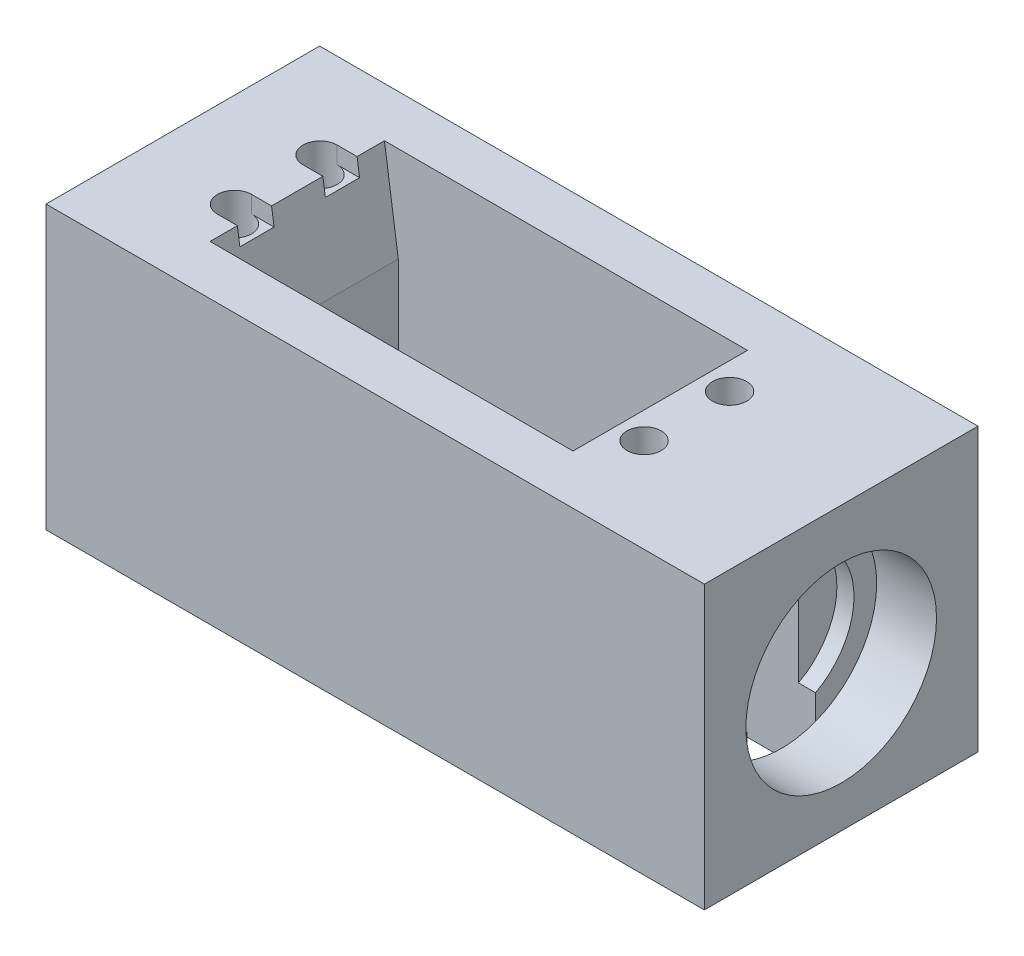
from build123d import *

# Parameters (mm, degrees)
BOSS_EXTRUDE1_DEPTH  = 5
SKETCH6_R            = 2
CUT_EXTRUDE3_DEPTH   = 53.239831546
SKETCH7_W            = 56
SKETCH7_H            = 6
BOSS_EXTRUDE2_DEPTH  = 28
SKETCH9_W            = 20
SKETCH9_H            = 28
BOSS_EXTRUDE3_DEPTH  = 2
SKETCH8_W            = 26
SKETCH8_H            = 33
BOSS_EXTRUDE4_DEPTH  = 2
BOSS_EXTRUDE5_START  = 28
SKETCH10_W           = 8
SKETCH10_H           = 20
SKETCH10_R           = 2
BOSS_EXTRUDE5_DEPTH  = 28
CUT_EXTRUDE4_DEPTH   = 20
SKETCH13_W           = 3.95
SKETCH13_H           = 4
CUT_EXTRUDE5_DEPTH   = 2
SKETCH14_W           = 60
SKETCH14_H           = 33
BOSS_EXTRUDE6_DEPTH  = 6
SKETCH15_R           = 2
BOSS_EXTRUDE7_DEPTH  = 20
SKETCH16_W           = 32
SKETCH16_H           = 33
BOSS_EXTRUDE8_DEPTH  = 12
SKETCH20_W           = 32
SKETCH20_H           = 33
BOSS_EXTRUDE9_DEPTH  = 5
SKETCH17_R           = 11.15
CUT_EXTRUDE6_DEPTH   = 7
CUT_EXTRUDE7_START   = -7
SKETCH19_R           = 11.15
CUT_EXTRUDE7_DEPTH   = 7
SKETCH21_R           = 8.5
CUT_EXTRUDE8_DEPTH   = 2
CUT_EXTRUDE10_START  = -28
SKETCH22_W           = 7
SKETCH22_H           = 8
CUT_EXTRUDE10_DEPTH  = 28
SKETCH25_W           = 8
SKETCH25_H           = 6
BOSS_EXTRUDE10_DEPTH = 28
CUT_EXTRUDE11_START  = -12
SKETCH26_R           = 2
CUT_EXTRUDE11_DEPTH  = 12
CUT_EXTRUDE12_START  = -2
SKETCH27_R           = 8.5
CUT_EXTRUDE12_DEPTH  = 2
CUT_EXTRUDE13_DEPTH  = 0.2
CUT_EXTRUDE14_DEPTH  = 0.2


with BuildPart() as part:
    # Sketch2 → Boss-Extrude1 (new body)
    with BuildSketch(Plane(origin=(0, 0, 0), x_dir=(1, 0, 0), z_dir=(0, 1, 0))):
        Polygon((0, 0), (0, 20), (-8, 20), (-8, -6), (48, -6), (48, 20), (40, 20), (40, 0), align=None)
    extrude(amount=BOSS_EXTRUDE1_DEPTH)

    # Sketch6 → Cut-Extrude3 (cut, through all)
    with BuildSketch(Plane.XZ):
        with Locations(Location((43.95, -5, 0), (0, 0, 270))):
            Circle(SKETCH6_R)
        with Locations(Location((43.95, -15, 0), (0, 0, 270))):
            Circle(SKETCH6_R)
        with Locations(Location((-3.95, -5, 0), (0, 0, 270))):
            Circle(SKETCH6_R)
        with Locations(Location((-3.95, -15, 0), (0, 0, 270))):
            Circle(SKETCH6_R)
    extrude(amount=-CUT_EXTRUDE3_DEPTH, mode=Mode.SUBTRACT)

    # Sketch7 → Boss-Extrude2 (add)
    with BuildSketch(Plane.XZ):
        with Locations((20, 3)):
            Rectangle(SKETCH7_W, SKETCH7_H)
    extrude(amount=BOSS_EXTRUDE2_DEPTH)

    # Sketch9 → Boss-Extrude3 (add)
    with BuildSketch(Plane.ZY.offset(8)):
        Polygon((-20, 5), (-20, 0), (0, 0), (0, -28), (6, -28), (6, 5), align=None)
        with Locations((-10, -14)):
            Rectangle(SKETCH9_W, SKETCH9_H)
    extrude(amount=BOSS_EXTRUDE3_DEPTH)

    # Sketch8 → Boss-Extrude4 (add)
    with BuildSketch(Plane(origin=(48, 0, 0), x_dir=(0, 0, -1), z_dir=(1, 0, 0))):
        with Locations((7, -11.5)):
            Rectangle(SKETCH8_W, SKETCH8_H)
    extrude(amount=BOSS_EXTRUDE4_DEPTH)

    # Sketch10 → Boss-Extrude5 (add)
    with BuildSketch(Plane.XZ.offset(BOSS_EXTRUDE5_START)):
        with Locations((-4, -10)):
            Rectangle(SKETCH10_W, SKETCH10_H)
        with Locations(Location((-3.95, -5, 0), (0, 0, 270))):
            Circle(SKETCH10_R, mode=Mode.SUBTRACT)
        with Locations(Location((-3.95, -15, 0), (0, 0, 270))):
            Circle(SKETCH10_R, mode=Mode.SUBTRACT)
    extrude(amount=-BOSS_EXTRUDE5_DEPTH)

    # Sketch12 → Cut-Extrude4 (cut)
    with BuildSketch(Plane(origin=(0, 0, -20), x_dir=(-1, 0, 0), z_dir=(0, 0, -1))):
        Polygon((-40, 5), (-40, 2.5), (-40.83785019, 5), align=None)
        Polygon((0, -6.167201623), (1.617522403, 5), (0, 5), align=None)
    extrude(amount=-CUT_EXTRUDE4_DEPTH, mode=Mode.SUBTRACT)

    # Sketch13 → Cut-Extrude5 (cut)
    with BuildSketch(Plane(origin=(0, 5, 0), x_dir=(1, 0, 0), z_dir=(0, 1, 0))):
        with Locations((-1.975, 5)):
            Rectangle(SKETCH13_W, SKETCH13_H)
        with Locations((-1.975, 15)):
            Rectangle(SKETCH13_W, SKETCH13_H)
    extrude(amount=-CUT_EXTRUDE5_DEPTH, mode=Mode.SUBTRACT)

    # Sketch14 → Boss-Extrude6 (add)
    with BuildSketch(Plane(origin=(0, 0, -20), x_dir=(-1, 0, 0), z_dir=(0, 0, -1))):
        with Locations((-20, -11.5)):
            Rectangle(SKETCH14_W, SKETCH14_H)
    extrude(amount=BOSS_EXTRUDE6_DEPTH)

    # Sketch15 → Boss-Extrude7 (add)
    with BuildSketch(Plane.XZ.offset(28)):
        with Locations(Location((-3.95, -5, 0), (0, 0, 270))):
            Circle(SKETCH15_R)
        with Locations(Location((-3.95, -15, 0), (0, 0, 270))):
            Circle(SKETCH15_R)
    extrude(amount=-BOSS_EXTRUDE7_DEPTH)

    # Sketch16 → Boss-Extrude8 (add)
    with BuildSketch(Plane(origin=(50, 0, 0), x_dir=(0, 0, -1), z_dir=(1, 0, 0))):
        with Locations((10, -11.5)):
            Rectangle(SKETCH16_W, SKETCH16_H)
    extrude(amount=BOSS_EXTRUDE8_DEPTH)

    # Sketch20 → Boss-Extrude9 (add)
    with BuildSketch(Plane.ZY.offset(10)):
        with Locations((-10, -11.5)):
            Rectangle(SKETCH20_W, SKETCH20_H)
    extrude(amount=BOSS_EXTRUDE9_DEPTH)

    # Sketch17 → Cut-Extrude6 (cut)
    with BuildSketch(Plane(origin=(62, 0, 0), x_dir=(0, 0, -1), z_dir=(1, 0, 0))):
        with Locations((10, -12)):
            Circle(SKETCH17_R)
    extrude(amount=-CUT_EXTRUDE6_DEPTH, mode=Mode.SUBTRACT)

    # Sketch19 → Cut-Extrude7 (cut)
    with BuildSketch(Plane.ZY.offset(15).offset(CUT_EXTRUDE7_START)):
        with Locations(Location((-10, -12, 0), (0, 0, 180))):
            Circle(SKETCH19_R)
    extrude(amount=CUT_EXTRUDE7_DEPTH, mode=Mode.SUBTRACT)

    # Sketch21 → Cut-Extrude8 (cut)
    with BuildSketch(Plane(origin=(55, 0, 0), x_dir=(0, 0, -1), z_dir=(1, 0, 0))):
        with Locations((10, -12)):
            Circle(SKETCH21_R)
    extrude(amount=-CUT_EXTRUDE8_DEPTH, mode=Mode.SUBTRACT)

    # Sketch22 → Cut-Extrude10 (cut)
    with BuildSketch(Plane.XZ.offset(28).offset(CUT_EXTRUDE10_START)):
        with Locations((51.5, -10)):
            Rectangle(SKETCH22_W, SKETCH22_H)
    extrude(amount=CUT_EXTRUDE10_DEPTH, mode=Mode.SUBTRACT)

    # Sketch25 → Boss-Extrude10 (add)
    with BuildSketch(Plane.XZ):
        with Locations((44, -3)):
            Rectangle(SKETCH25_W, SKETCH25_H)
        with Locations((44, -17)):
            Rectangle(SKETCH25_W, SKETCH25_H)
    extrude(amount=BOSS_EXTRUDE10_DEPTH)

    # Sketch26 → Cut-Extrude11 (cut)
    with BuildSketch(Plane(origin=(0, 5, 0), x_dir=(1, 0, 0), z_dir=(0, 1, 0)).offset(CUT_EXTRUDE11_START)):
        with Locations(Location((43.95, 5, 0), (0, 0, 90))):
            Circle(SKETCH26_R)
        with Locations(Location((43.95, 15, 0), (0, 0, 90))):
            Circle(SKETCH26_R)
    extrude(amount=CUT_EXTRUDE11_DEPTH, mode=Mode.SUBTRACT)

    # Sketch27 → Cut-Extrude12 (cut)
    with BuildSketch(Plane.ZY.offset(8).offset(CUT_EXTRUDE12_START)):
        with Locations((-10, -12)):
            Circle(SKETCH27_R)
    extrude(amount=CUT_EXTRUDE12_DEPTH, mode=Mode.SUBTRACT)

    # Sketch28 → Cut-Extrude13 (cut)
    with BuildSketch(Plane(origin=(0, 0, 0), x_dir=(-1, 0, 0), z_dir=(0, 0, -1))):
        Polygon((-40, 2.5), (-40, -28), (0, -28), (0, -6.167201623), (1.617522403, 5), (-40.83785019, 5), align=None)
    extrude(amount=-CUT_EXTRUDE13_DEPTH, mode=Mode.SUBTRACT)

    # Sketch29 → Cut-Extrude14 (cut)
    with BuildSketch(Plane.XY.offset(-20)):
        Polygon((0, -28), (40, -28), (40, 2.5), (40.83785019, 5), (-1.617522403, 5), (0, -6.167201623), align=None)
    extrude(amount=-CUT_EXTRUDE14_DEPTH, mode=Mode.SUBTRACT)


solid = part.part
